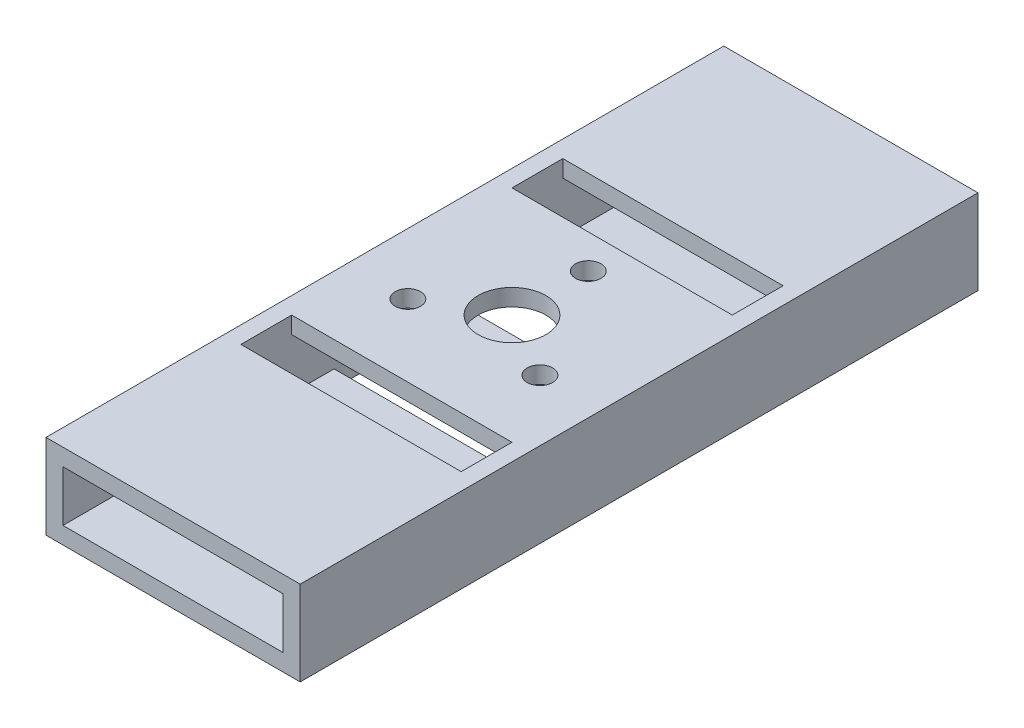
from build123d import *

# Parameters (mm, degrees)
ESBO_O1_W                = 30
ESBO_O1_H                = 10
ESBO_O1_W_2              = 26
ESBO_O1_H_2              = 6
RESSALTO_EXTRUS_O1_DEPTH = 80
ESBO_O2_R                = 4
CORTE_EXTRUS_O1_DEPTH    = 10
ESBO_O4_R                = 1.5
CORTE_EXTRUS_O2_DEPTH    = 2
ESBO_O6_R                = 2
CORTE_EXTRUS_O4_DEPTH    = 2
ESBO_O7_W                = 26
ESBO_O7_H                = 6
CORTE_EXTRUS_O5_DEPTH    = 2
ESBO_O8_W                = 26
ESBO_O8_H                = 6
CORTE_EXTRUS_O6_DEPTH    = 2
ESBO_O10_W               = 26
ESBO_O10_H               = 8
CORTE_EXTRUS_O7_DEPTH    = 2


with BuildPart() as part:
    # Esboço1 → Ressalto-extrusão1 (new body)
    with BuildSketch(Plane.XY):
        Rectangle(ESBO_O1_W, ESBO_O1_H)
        Rectangle(ESBO_O1_W_2, ESBO_O1_H_2, mode=Mode.SUBTRACT)
    extrude(amount=RESSALTO_EXTRUS_O1_DEPTH)

    # Esboço2 → Corte-extrusão1 (cut)
    with BuildSketch(Plane(origin=(0, 5, 0), x_dir=(1, 0, 0), z_dir=(0, 1, 0))):
        with Locations(Location((0, -40, 0), (0, 0, 270))):
            Circle(ESBO_O2_R)
    extrude(amount=-CORTE_EXTRUS_O1_DEPTH, mode=Mode.SUBTRACT)

    # Esboço4 → Corte-extrusão2 (cut)
    with BuildSketch(Plane(origin=(0, 5, 0), x_dir=(1, 0, 0), z_dir=(0, 1, 0))):
        with Locations(Location((0, -31, 0), (0, 0, 270))):
            Circle(ESBO_O4_R)
        with Locations(Location((7.794228634, -44.5, 0), (0, 0, 270))):
            Circle(ESBO_O4_R)
        with Locations(Location((-7.794228634, -44.5, 0), (0, 0, 270))):
            Circle(ESBO_O4_R)
    extrude(amount=-CORTE_EXTRUS_O2_DEPTH, mode=Mode.SUBTRACT)

    # Esboço6 → Corte-extrusão4 (cut)
    with BuildSketch(Plane(origin=(0, -5, 0), x_dir=(-1, 0, 0), z_dir=(0, -1, 0))):
        with Locations(Location((0, -56, 0), (0, 0, 90))):
            Circle(ESBO_O6_R)
    corte_extrus_o4 = extrude(amount=-CORTE_EXTRUS_O4_DEPTH, mode=Mode.SUBTRACT)

    # Espelhar1: Corte-extrusão4 across plane
    add(corte_extrus_o4.mirror(Plane.XY.offset(40)), mode=Mode.SUBTRACT)

    # Esboço7 → Corte-extrusão5 (cut)
    with BuildSketch(Plane(origin=(0, 5, 0), x_dir=(1, 0, 0), z_dir=(0, 1, 0))):
        with Locations((0, -24)):
            Rectangle(ESBO_O7_W, ESBO_O7_H)
    corte_extrus_o5 = extrude(amount=-CORTE_EXTRUS_O5_DEPTH, mode=Mode.SUBTRACT)

    # Espelhar2: Corte-extrusão5 across plane
    add(corte_extrus_o5.mirror(Plane.XY.offset(40)), mode=Mode.SUBTRACT)

    # Esboço8 → Corte-extrusão6 (cut)
    with BuildSketch(Plane(origin=(0, -5, 0), x_dir=(-1, 0, 0), z_dir=(0, -1, 0))):
        with Locations((0, -31)):
            Rectangle(ESBO_O8_W, ESBO_O8_H)
    extrude(amount=-CORTE_EXTRUS_O6_DEPTH, mode=Mode.SUBTRACT)

    # Esboço10 → Corte-extrusão7 (cut)
    with BuildSketch(Plane(origin=(0, -5, 0), x_dir=(-1, 0, 0), z_dir=(0, -1, 0))):
        with Locations((0, -44)):
            Rectangle(ESBO_O10_W, ESBO_O10_H)
    extrude(amount=-CORTE_EXTRUS_O7_DEPTH, mode=Mode.SUBTRACT)


solid = part.part
